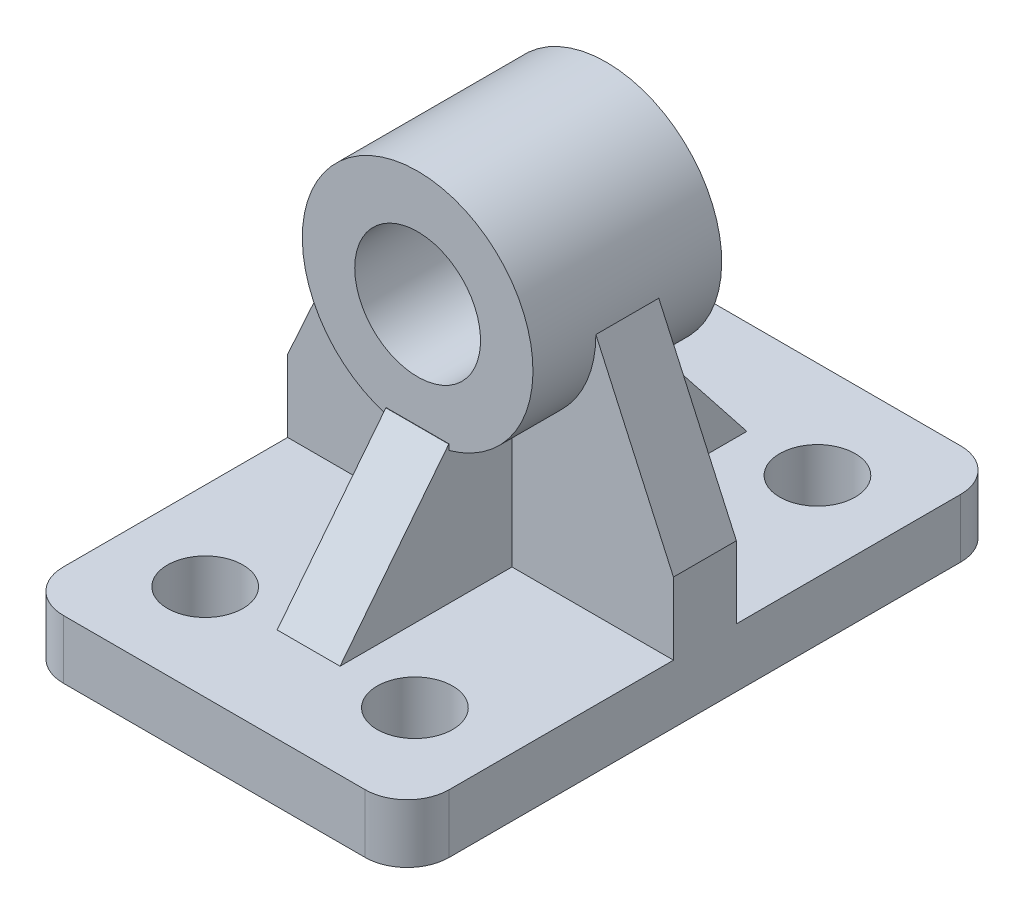
from build123d import *

# Parameters (mm, degrees)
SKETCH1_R           = 9
BOSS_EXTRUDE1_DEPTH = 14
SKETCH2_R           = 27.5
SKETCH2_R_2         = 15
BOSS_EXTRUDE2_DEPTH = 22.5
SKETCH3_R           = 27.5
SKETCH3_R_2         = 15
BOSS_EXTRUDE3_DEPTH = 22.5
BOSS_EXTRUDE4_DEPTH = 7.5
BOSS_EXTRUDE9_DEPTH = 7.5


with BuildPart() as part:
    # Sketch1 → Boss-Extrude1 (new body)
    with BuildSketch(Plane(origin=(0, 0, 0), x_dir=(1, 0, 0), z_dir=(0, 1, 0))):
        with BuildLine():
            Line((153.801246265, 0), (225.801246265, 0))
            ThreePointArc((225.801246265, 0), (232.872314076, 2.928932188), (235.801246265, 10))
            Line((235.801246265, 10), (235.801246265, 132))
            ThreePointArc((235.801246265, 132), (232.872314076, 139.071067812), (225.801246265, 142))
            Line((225.801246265, 142), (153.801246265, 142))
            ThreePointArc((153.801246265, 142), (146.730178453, 139.071067812), (143.801246265, 132))
            Line((143.801246265, 132), (143.801246265, 10))
            ThreePointArc((143.801246265, 10), (146.730178453, 2.928932188), (153.801246265, 0))
        make_face()
        with Locations(Location((164.801246265, 22.845020392, 0), (0, 0, 270))):
            Circle(SKETCH1_R, mode=Mode.SUBTRACT)
        with Locations(Location((214.801246265, 22.845020392, 0), (0, 0, 270))):
            Circle(SKETCH1_R, mode=Mode.SUBTRACT)
        with Locations(Location((214.801246265, 118.829727622, 0), (0, 0, 270))):
            Circle(SKETCH1_R, mode=Mode.SUBTRACT)
        with Locations(Location((164.801246265, 118.829727622, 0), (0, 0, 270))):
            Circle(SKETCH1_R, mode=Mode.SUBTRACT)
    extrude(amount=-BOSS_EXTRUDE1_DEPTH)



with BuildPart() as body_2:
    # Sketch2 → Boss-Extrude2 (new body)
    with BuildSketch(Plane.XY.offset(-71)):
        with Locations(Location((189.801246265, 58, 0), (0, 0, 180))):
            Circle(SKETCH2_R)
        with Locations(Location((189.801246265, 58, 0), (0, 0, 180))):
            Circle(SKETCH2_R_2, mode=Mode.SUBTRACT)
    extrude(amount=BOSS_EXTRUDE2_DEPTH)

    # Sketch3 → Boss-Extrude3 (add)
    with BuildSketch(Plane(origin=(0, 0, -71), x_dir=(-1, 0, 0), z_dir=(0, 0, -1))):
        with Locations((-189.801246265, 58)):
            Circle(SKETCH3_R)
        with Locations((-189.801246265, 58)):
            Circle(SKETCH3_R_2, mode=Mode.SUBTRACT)
    extrude(amount=BOSS_EXTRUDE3_DEPTH)


with BuildPart() as part_1:
    add(part.part)

    add(body_2.part)  # Boss-Extrude4 merges body 2
    # Sketch4 → Boss-Extrude4 (add, symmetric)
    with BuildSketch(Plane.XY.offset(-71)):
        with BuildLine():
            Line((143.801246265, 0), (235.801246265, 0))
            Line((235.801246265, 0), (235.801246265, 17.16449016))
            Line((235.801246265, 17.16449016), (217.301246265, 58))
            ThreePointArc((217.301246265, 58), (189.801246265, 30.5), (162.301246265, 58))
            Line((162.301246265, 58), (143.801246265, 17.16449016))
            Line((143.801246265, 17.16449016), (143.801246265, 0))
        make_face()
    extrude(amount=BOSS_EXTRUDE4_DEPTH, both=True)

    # Sketch6 → Boss-Extrude9 (add, symmetric)
    with BuildSketch(Plane.ZY.offset(-189.801246265)):
        Polygon((-119.5, 0), (-78.5, 0), (-76.506871872, 0), (-76.506871872, 30.5), (-76.506871872, 32.905088901), (-93.5, 32.905088901), align=None)
        Polygon((-22.5, 0), (-63.5, 0), (-65.39508201, 0), (-65.39508201, 32.905088901), (-48.424150578, 32.905088901), align=None)
    extrude(amount=BOSS_EXTRUDE9_DEPTH, both=True)


solid = part_1.part
